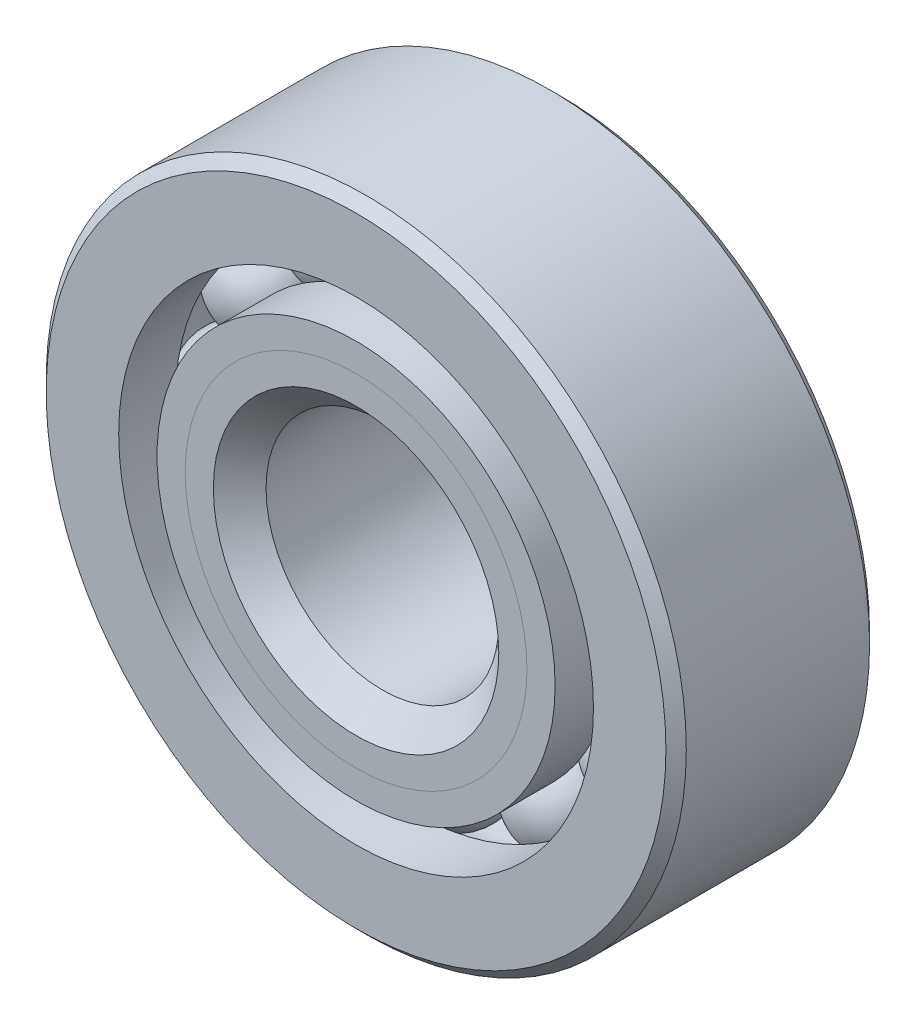
from build123d import *

# Parameters (mm, degrees)
CIRPATTERN1_COUNT = 12


with BuildPart() as part:
    # Sketch1 → Revolve1 (revolve)
    with BuildSketch(Plane(origin=(0, 0, 0), x_dir=(0, 0, -1), z_dir=(1, 0, 0))):
        with BuildLine():
            Line((5.000625, 17.4625), (-5.000625, 17.4625))
            Line((-5.000625, 17.4625), (-5.55625, 16.906875))
            Line((-5.55625, 16.906875), (-5.55625, 12.952953297))
            Line((-5.55625, 12.952953297), (-2.469444444, 12.952953297))
            ThreePointArc((-2.469444444, 12.952953297), (0, 14.588365519), (2.469444444, 12.952953297))
            Line((2.469444444, 12.952953297), (5.55625, 12.952953297))
            Line((5.55625, 12.952953297), (5.55625, 16.906875))
            Line((5.55625, 16.906875), (5.000625, 17.4625))
        make_face()
    revolve(axis=Axis((0, 0, 5.55625), (0, 0, -1)))


with BuildPart() as body_2:
    # Sketch2 → Revolve2 (revolve)
    with BuildSketch(Plane(origin=(0, 0, 0), x_dir=(0, 0, -1), z_dir=(1, 0, 0))):
        with BuildLine():
            Line((-5.55625, 10.859546703), (-2.469444444, 10.859546703))
            ThreePointArc((-2.469444444, 10.859546703), (-1.480939651, 9.670056492), (0, 9.224134481))
            Line((0, 9.224134481), (0, 7.787067241))
            Line((0, 7.787067241), (-4.020010269, 7.787067241))
            Line((-4.020010269, 7.787067241), (-5.55625, 9.323306972))
            Line((-5.55625, 9.323306972), (-5.55625, 10.859546703))
        make_face()
    revolve(axis=Axis((0, 0, 5.55625), (0, 0, -1)))


with BuildPart() as body_3:
    # Sketch3 → Revolve3 (revolve)
    with BuildSketch(Plane(origin=(0, 0, 0), x_dir=(0, 0, -1), z_dir=(1, 0, 0))):
        with BuildLine():
            Line((-5.55625, 9.323306972), (-4.020010269, 7.787067241))
            Line((-4.020010269, 7.787067241), (0, 7.787067241))
            Line((0, 7.787067241), (0, 9.224134481))
            ThreePointArc((0, 9.224134481), (1.480939651, 9.670056492), (2.469444444, 10.859546703))
            Line((2.469444444, 10.859546703), (5.55625, 10.859546703))
            Line((5.55625, 10.859546703), (5.55625, 6.905625))
            Line((5.55625, 6.905625), (5.000625, 6.35))
            Line((5.000625, 6.35), (-4.119182759, 6.35))
            Line((-4.119182759, 6.35), (-5.55625, 7.787067241))
            Line((-5.55625, 7.787067241), (-5.55625, 9.323306972))
        make_face()
    revolve(axis=Axis((0, 0, 5.55625), (0, 0, -1)))


with BuildPart() as body_4:
    # Sketch4 → Revolve4 (revolve)
    with BuildSketch(Plane(origin=(0, 0, 0), x_dir=(0, 0, -1), z_dir=(1, 0, 0))):
        with BuildLine():
            Line((-2.682115519, 11.90625), (2.682115519, 11.90625))
            ThreePointArc((2.682115519, 11.90625), (0, 14.588365519), (-2.682115519, 11.90625))
        make_face()
    revolve(axis=Axis((0, 11.90625, 2.682115519), (0, 0, -1)))


with BuildPart() as cirpattern1_1:
    # CirPattern1: pattern copy
    add(body_4.part.rotate(Axis((0, 0, -5.55625), (0, 0, 1)), 1 * 360 / CIRPATTERN1_COUNT))


with BuildPart() as cirpattern1_2:
    # CirPattern1: pattern copy
    add(body_4.part.rotate(Axis((0, 0, -5.55625), (0, 0, 1)), 2 * 360 / CIRPATTERN1_COUNT))


with BuildPart() as cirpattern1_3:
    # CirPattern1: pattern copy
    add(body_4.part.rotate(Axis((0, 0, -5.55625), (0, 0, 1)), 3 * 360 / CIRPATTERN1_COUNT))


with BuildPart() as cirpattern1_4:
    # CirPattern1: pattern copy
    add(body_4.part.rotate(Axis((0, 0, -5.55625), (0, 0, 1)), 4 * 360 / CIRPATTERN1_COUNT))


with BuildPart() as cirpattern1_5:
    # CirPattern1: pattern copy
    add(body_4.part.rotate(Axis((0, 0, -5.55625), (0, 0, 1)), 5 * 360 / CIRPATTERN1_COUNT))


with BuildPart() as cirpattern1_6:
    # CirPattern1: pattern copy
    add(body_4.part.rotate(Axis((0, 0, -5.55625), (0, 0, 1)), 6 * 360 / CIRPATTERN1_COUNT))


with BuildPart() as cirpattern1_7:
    # CirPattern1: pattern copy
    add(body_4.part.rotate(Axis((0, 0, -5.55625), (0, 0, 1)), 7 * 360 / CIRPATTERN1_COUNT))


with BuildPart() as cirpattern1_8:
    # CirPattern1: pattern copy
    add(body_4.part.rotate(Axis((0, 0, -5.55625), (0, 0, 1)), 8 * 360 / CIRPATTERN1_COUNT))


with BuildPart() as cirpattern1_9:
    # CirPattern1: pattern copy
    add(body_4.part.rotate(Axis((0, 0, -5.55625), (0, 0, 1)), 9 * 360 / CIRPATTERN1_COUNT))


with BuildPart() as cirpattern1_10:
    # CirPattern1: pattern copy
    add(body_4.part.rotate(Axis((0, 0, -5.55625), (0, 0, 1)), 10 * 360 / CIRPATTERN1_COUNT))


with BuildPart() as cirpattern1_11:
    # CirPattern1: pattern copy
    add(body_4.part.rotate(Axis((0, 0, -5.55625), (0, 0, 1)), 11 * 360 / CIRPATTERN1_COUNT))


solid = Compound([part.part, body_2.part, body_3.part, body_4.part, cirpattern1_1.part, cirpattern1_2.part, cirpattern1_3.part, cirpattern1_4.part, cirpattern1_5.part, cirpattern1_6.part, cirpattern1_7.part, cirpattern1_8.part, cirpattern1_9.part, cirpattern1_10.part, cirpattern1_11.part])
